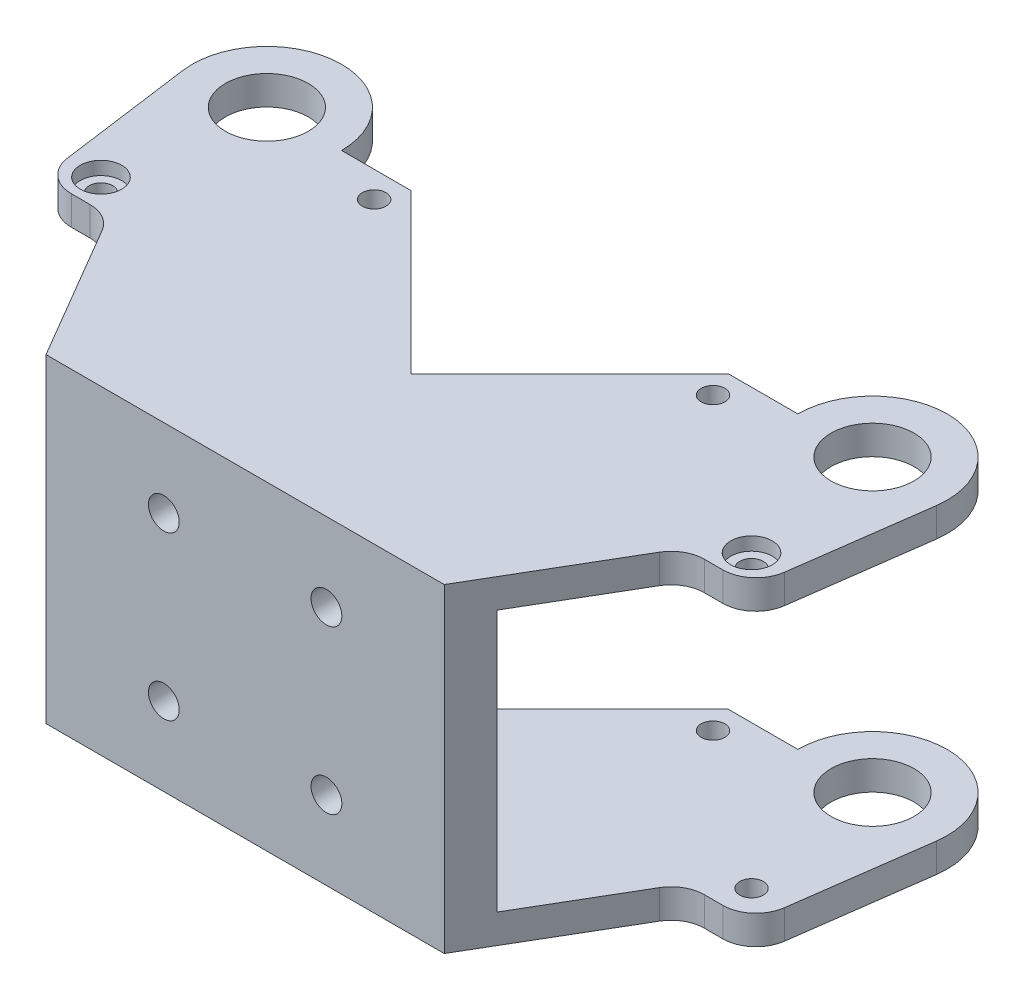
from build123d import *

# Parameters (mm, degrees)
SKETCH1_R            = 3.96875
BOSS_EXTRUDE1_DEPTH  = 15.286125003
SKETCH2_W            = 35.01875
SKETCH2_H            = 25.016000006
CUT_EXTRUDE1_DEPTH   = 40.686125003
SKETCH3_R            = 1.1303
CUT_EXTRUDE2_DEPTH   = 52.042953466
FILLET1_R            = 3.175
SKETCH9_R            = 1.1303
CUT_EXTRUDE5_DEPTH   = 52.042953466
FILLET1_OF_MIRROR3_R = 3.175
SKETCH7_R            = 1.4732
CUT_EXTRUDE3_DEPTH   = 55.741808709
SKETCH8_R            = 1.984375
CUT_EXTRUDE4_DEPTH   = 1.27


with BuildPart() as part:
    # Sketch1 → Boss-Extrude1 (new, symmetric)
    with BuildSketch(Plane(origin=(0, 0, 0), x_dir=(1, 0, 0), z_dir=(0, 1, 0))):
        with BuildLine():
            Line((0, -3.175), (0, -19.05))
            Line((0, -19.05), (19.05, -19.05))
            Line((19.05, -19.05), (27.573163108, -4.51))
            Line((27.573163108, -4.51), (33.923163108, -4.51))
            Line((33.923163108, -4.51), (36.048366078, 11.032185755))
            ThreePointArc((36.048366078, 11.032185755), (29.455504341, 19.1272655), (21.826728, 12))
            Line((21.826728, 12), (15.175, 12))
            Line((15.175, 12), (0, -3.175))
        make_face()
        with Locations(Location((28.970478, 12, 0), (0, 0, 270))):
            Circle(SKETCH1_R, mode=Mode.SUBTRACT)
    boss_extrude1 = extrude(amount=BOSS_EXTRUDE1_DEPTH, both=True)

    # Sketch2 → Cut-Extrude1 (cut, symmetric)
    with BuildSketch(Plane(origin=(0, 0, 0), x_dir=(0, 0, -1), z_dir=(1, 0, 0))):
        with Locations((1.634375, 0)):
            Rectangle(SKETCH2_W, SKETCH2_H)
    cut_extrude1 = extrude(amount=CUT_EXTRUDE1_DEPTH, both=True, mode=Mode.SUBTRACT)

    # Sketch3 → Cut-Extrude2 (cut, through all)
    with BuildSketch(Plane(origin=(0, 15.286125003, 0), x_dir=(1, 0, 0), z_dir=(0, 1, 0))):
        with Locations(Location((31.117871418, -1.723399824, 0), (0, 0, 270))):
            Circle(SKETCH3_R)
    cut_extrude2 = extrude(amount=-CUT_EXTRUDE2_DEPTH, mode=Mode.SUBTRACT)

    # Fillet1
    fillet1_edges = [part.edges().sort_by_distance(p)[0] for p in [
        (33.923163108, 13.897062503, 4.51),
        (27.573163108, 13.897062503, 4.51),
        (33.923163108, -13.897062503, 4.51),
        (27.573163108, -13.897062503, 4.51),
    ]]
    fillet(fillet1_edges, radius=FILLET1_R)

    # Sketch9 → Cut-Extrude5 (cut, through all)
    with BuildSketch(Plane.XZ.offset(15.286125003)):
        with Locations(Location((16.210478, -9.5, 0), (0, 0, 270))):
            Circle(SKETCH9_R)
    cut_extrude5 = extrude(amount=-CUT_EXTRUDE5_DEPTH, mode=Mode.SUBTRACT)

    # Mirror3: Boss-Extrude1, Cut-Extrude1, Cut-Extrude2, Cut-Extrude5 across plane
    add(boss_extrude1.mirror(Plane(origin=(0, 15.286125003, 3.175), x_dir=(0, 0, 1), z_dir=(1, 0, 0))))
    add(cut_extrude1.mirror(Plane(origin=(0, 15.286125003, 3.175), x_dir=(0, 0, 1), z_dir=(1, 0, 0))), mode=Mode.SUBTRACT)
    add(cut_extrude2.mirror(Plane(origin=(0, 15.286125003, 3.175), x_dir=(0, 0, 1), z_dir=(1, 0, 0))), mode=Mode.SUBTRACT)
    add(cut_extrude5.mirror(Plane(origin=(0, 15.286125003, 3.175), x_dir=(0, 0, 1), z_dir=(1, 0, 0))), mode=Mode.SUBTRACT)

    # Fillet1 of Mirror3
    fillet1_of_mirror3_edges = [part.edges().sort_by_distance(p)[0] for p in [
        (-33.923163108, 13.897062503, 4.51),
        (-27.573163108, 13.897062503, 4.51),
        (-33.923163108, -13.897062503, 4.51),
        (-27.573163108, -13.897062503, 4.51),
    ]]
    fillet(fillet1_of_mirror3_edges, radius=FILLET1_OF_MIRROR3_R)

    # Sketch7 → Cut-Extrude3 (cut, through all)
    with BuildSketch(Plane.XY.offset(19.05)):
        with Locations((-7.778174593, 7.778174593)):
            Circle(SKETCH7_R)
        with Locations((7.778174593, 7.778174593)):
            Circle(SKETCH7_R)
        with Locations((7.778174593, -7.778174593)):
            Circle(SKETCH7_R)
        with Locations((-7.778174593, -7.778174593)):
            Circle(SKETCH7_R)
    extrude(amount=-CUT_EXTRUDE3_DEPTH, mode=Mode.SUBTRACT)

    # Sketch8 → Cut-Extrude4 (cut)
    with BuildSketch(Plane(origin=(0, 15.286125003, 0), x_dir=(1, 0, 0), z_dir=(0, 1, 0))):
        with Locations(Location((31.117871418, -1.723399824, 0), (0, 0, 270))):
            Circle(SKETCH8_R)
        with Locations(Location((-31.117871418, -1.723399824, 0), (0, 0, 270))):
            Circle(SKETCH8_R)
    extrude(amount=-CUT_EXTRUDE4_DEPTH, mode=Mode.SUBTRACT)


solid = part.part
